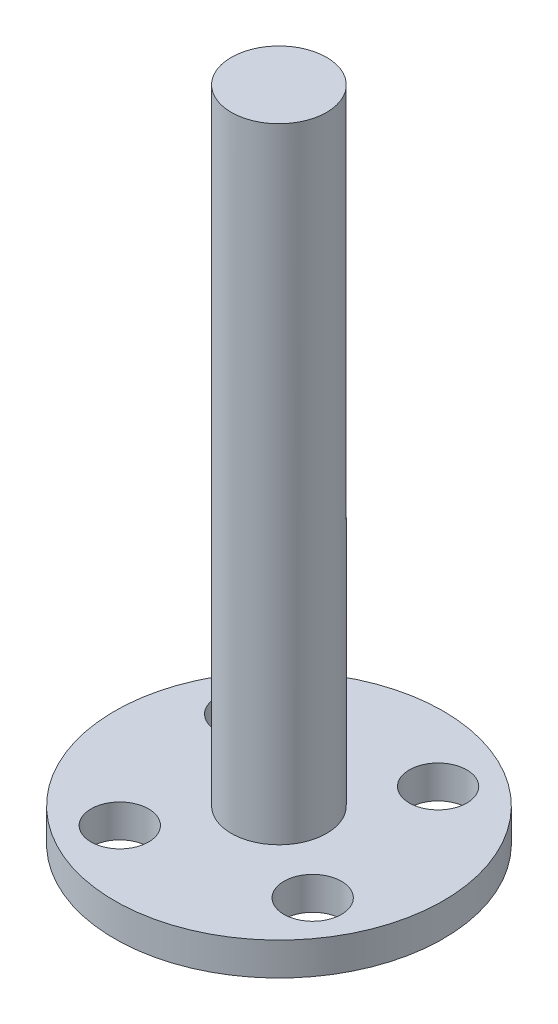
from build123d import *

# Parameters (mm, degrees)
SKETCH_1_R          = 2.9
EXTRUDE_1_DEPTH     = 40
SKETCH_2_R          = 10
EXTRUDE_2_DEPTH     = 2
SKETCH_3_R          = 1.75
CUT_EXTRUDE_1_DEPTH = 3


with BuildPart() as part:
    # 草图1 → 凸台-拉伸1 (new body)
    with BuildSketch(Plane(origin=(0, 0, 0), x_dir=(1, 0, 0), z_dir=(0, 1, 0))):
        with Locations(Location((0, 0, 0), (0, 0, 270))):
            Circle(SKETCH_1_R)
    extrude(amount=EXTRUDE_1_DEPTH)

    # 草图2 → 凸台-拉伸2 (add)
    with BuildSketch(Plane.XZ):
        with Locations(Location((0, 0, 0), (0, 0, 270))):
            Circle(SKETCH_2_R)
    extrude(amount=-EXTRUDE_2_DEPTH)

    # 草图3 → 切除-拉伸1 (cut)
    with BuildSketch(Plane(origin=(0, 2, 0), x_dir=(1, 0, 0), z_dir=(0, 1, 0))):
        with Locations(Location((-3.814504668, -5.869398434, 0), (0, 0, 270))):
            Circle(SKETCH_3_R)
        with Locations(Location((-5.869398434, 3.814504668, 0), (0, 0, 270))):
            Circle(SKETCH_3_R)
        with Locations(Location((3.814504668, 5.869398434, 0), (0, 0, 270))):
            Circle(SKETCH_3_R)
        with Locations(Location((5.869398434, -3.814504668, 0), (0, 0, 270))):
            Circle(SKETCH_3_R)
    extrude(amount=-CUT_EXTRUDE_1_DEPTH, mode=Mode.SUBTRACT)


solid = part.part
